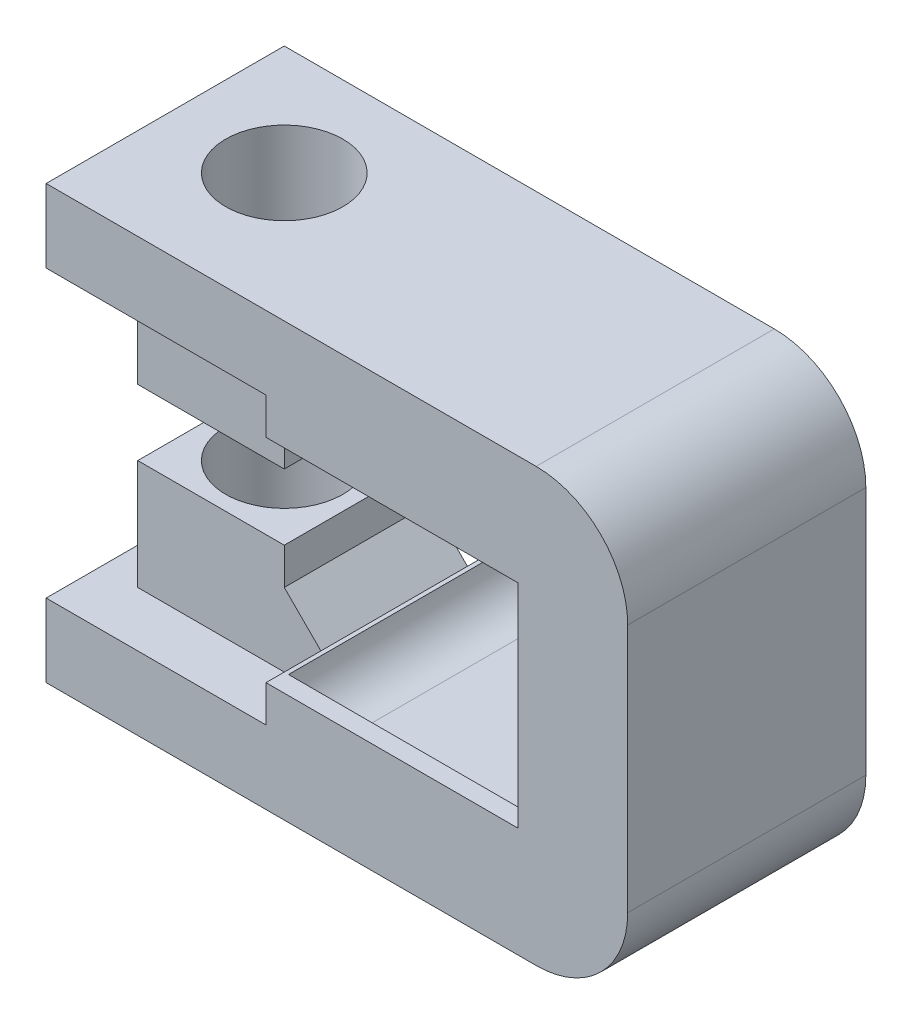
from build123d import *

# Parameters (mm, degrees)
EXTRUDE_1_DEPTH     = 12
EXTRUDE_2_DEPTH     = 1
SKETCH_2_W          = 8
SKETCH_2_H          = 8
SKETCH_2_R          = 3.2
EXTRUDE_3_DEPTH     = 10
CUT_EXTRUDE_2_REACH = 35.151
SKETCH_2_2_R        = 3.2
SKETCH_2_4_W        = 2
SKETCH_2_4_H        = 8
EXTRUDE_4_DEPTH     = 6
CHAMFER_1_SIZE      = 2
EXTRUDE_START       = -19.6
SKETCH_2_5_W        = 2
SKETCH_2_5_H        = 8
EXTRUDE_5_DEPTH     = 2
CHAMFER_2_SIZE      = 2
FILLET_1_R          = 5


with BuildPart() as part:
    # 草图1 → 凸台-拉伸1 (new body)
    with BuildSketch(Plane.XY):
        Polygon((-19.95, -7.8), (7.8, -7.8), (7.8, 7.8), (-19.95, 7.8), (-19.95, 11.8), (11.8, 11.8), (11.8, -11.8), (-19.95, -11.8), align=None)
        with BuildLine():
            Line((-5.15, 7.8), (-7.95, 7.8))
            Line((-7.95, 7.8), (-7.95, 5.8))
            Line((-7.95, 5.8), (-7.719046516, 5.8))
            ThreePointArc((-7.719046516, 5.8), (-6.77788206, 7.241052367), (-5.15, 7.8))
        make_face()
        with BuildLine():
            Line((-7.95, -5.8), (-7.95, -7.8))
            Line((-7.95, -7.8), (-5.15, -7.8))
            ThreePointArc((-5.15, -7.8), (-6.77788206, -7.241052367), (-7.719046516, -5.8))
            Line((-7.719046516, -5.8), (-7.95, -5.8))
        make_face()
        with BuildLine():
            ThreePointArc((7.8, -5.15), (7.02383297, -7.02383297), (5.15, -7.8))
            Line((5.15, -7.8), (7.8, -7.8))
            Line((7.8, -7.8), (7.8, -5.15))
        make_face()
        with BuildLine():
            ThreePointArc((5.15, 7.8), (7.02383297, 7.02383297), (7.8, 5.15))
            Line((7.8, 5.15), (7.8, 7.8))
            Line((7.8, 7.8), (5.15, 7.8))
        make_face()
    extrude(amount=-EXTRUDE_1_DEPTH)

    # 草图1<3> → 凸台-拉伸2 (add)
    with BuildSketch(Plane.XY):
        Polygon((-7.95, -7.8), (-19.95, -7.8), (-19.95, -11.8), (11.8, -11.8), (11.8, 11.8), (-19.95, 11.8), (-19.95, 7.8), (-7.95, 7.8), (-7.95, 5.8), (5.8, 5.8), (5.8, -5.8), (-7.95, -5.8), align=None)
    extrude(amount=EXTRUDE_2_DEPTH)

    # 草图2 → 凸台-拉伸3 (add)
    with BuildSketch(Plane.XZ.offset(11.8)):
        with Locations((-13.95, -6)):
            Rectangle(SKETCH_2_W, SKETCH_2_H)
        with Locations(Location((-13.95, -6, 0), (0, 0, 270))):
            Circle(SKETCH_2_R, mode=Mode.SUBTRACT)
    extrude_3 = extrude(amount=-EXTRUDE_3_DEPTH)

    # 草图2<2> → 切除-拉伸2 (cut, up to next)
    with BuildSketch(Plane.XZ.offset(11.8), mode=Mode.PRIVATE) as cut_extrude_2_sk1:
        with Locations(Location((-13.95, -6, 0), (0, 0, 270))):
            Circle(SKETCH_2_2_R)
    cut_extrude_2_tool1 = extrude(cut_extrude_2_sk1.sketch, amount=-CUT_EXTRUDE_2_REACH, mode=Mode.PRIVATE) & part.part
    cut_extrude_2 = cut_extrude_2_tool1.solids().sort_by_distance((-13.95, -11.8, -6))[0]
    add(cut_extrude_2, mode=Mode.SUBTRACT)

    # 草图2<4> → 凸台-拉伸4 (add)
    with BuildSketch(Plane.XZ.offset(11.8)):
        with Locations((-8.95, -6)):
            Rectangle(SKETCH_2_4_W, SKETCH_2_4_H)
    extrude(amount=-EXTRUDE_4_DEPTH)

    # 倒角1
    chamfer_1_edges = [part.edges().sort_by_distance(p)[0] for p in [
        (-9.95, -5.8, -6),
    ]]
    chamfer(chamfer_1_edges, length=CHAMFER_1_SIZE)

    # 镜向6: 凸台-拉伸3, 切除-拉伸2 across plane
    add(extrude_3.mirror(Plane.ZX))
    add(cut_extrude_2.mirror(Plane.ZX), mode=Mode.SUBTRACT)

    # 草图2<5> → 凸台-拉伸5 (add)
    with BuildSketch(Plane.XZ.offset(11.8).offset(EXTRUDE_START)):
        with Locations((-8.95, -6)):
            Rectangle(SKETCH_2_5_W, SKETCH_2_5_H)
    extrude(amount=EXTRUDE_5_DEPTH)

    # 倒角2
    chamfer_2_edges = [part.edges().sort_by_distance(p)[0] for p in [
        (-9.95, 5.8, -6),
    ]]
    chamfer(chamfer_2_edges, length=CHAMFER_2_SIZE)

    # 圆角1
    fillet_1_edges = [part.edges().sort_by_distance(p)[0] for p in [
        (11.8, 11.8, -5.5),
        (11.8, -11.8, -5.5),
    ]]
    fillet(fillet_1_edges, radius=FILLET_1_R)


solid = part.part
